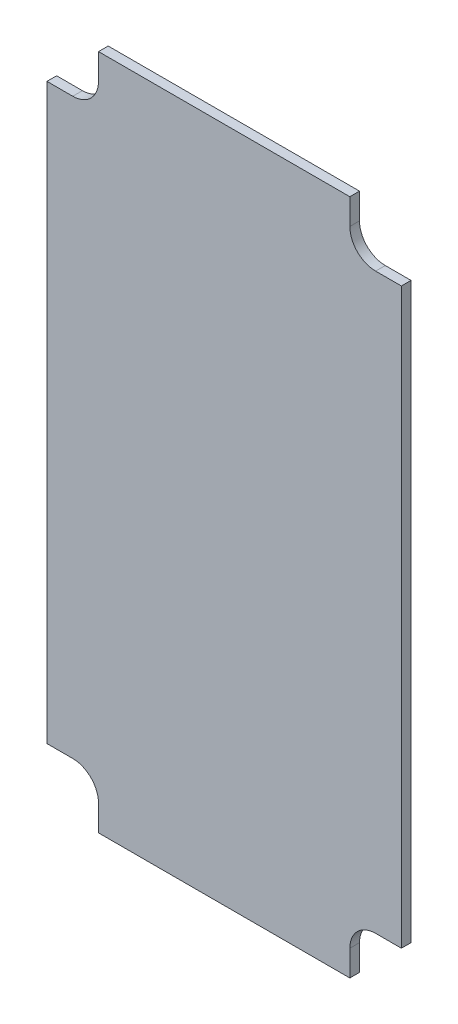
from build123d import *

# Parameters (mm, degrees)
CROQUIS1_W              = 55
CROQUIS1_H              = 105
SALIENTE_EXTRUIR1_DEPTH = 1.5
CORTAR_EXTRUIR1_REACH   = 61.285


with BuildPart() as part:
    # Croquis1 → Saliente-Extruir1 (new body)
    with BuildSketch(Plane.XY):
        Rectangle(CROQUIS1_W, CROQUIS1_H)
    extrude(amount=SALIENTE_EXTRUIR1_DEPTH)

    # Croquis2 → Cortar-Extruir1 (cut, up to next)
    with BuildSketch(Plane.XY.offset(1.5), mode=Mode.PRIVATE) as cortar_extruir1_sk1:
        with BuildLine():
            Line((-19.5, -48.5), (-19.5, -52.5))
            Line((-19.5, -52.5), (-27.5, -52.5))
            Line((-27.5, -52.5), (-27.5, -44.5))
            Line((-27.5, -44.5), (-23.5, -44.5))
            ThreePointArc((-23.5, -44.5), (-20.671572875, -45.671572875), (-19.5, -48.5))
        make_face()
    cortar_extruir1_tool1 = extrude(cortar_extruir1_sk1.sketch, amount=-CORTAR_EXTRUIR1_REACH, mode=Mode.PRIVATE) & part.part
    # Croquis2 → Cortar-Extruir1 (cut, up to next)
    with BuildSketch(Plane.XY.offset(1.5), mode=Mode.PRIVATE) as cortar_extruir1_sk2:
        with BuildLine():
            Line((19.5, -48.5), (19.5, -52.5))
            Line((19.5, -52.5), (27.5, -52.5))
            Line((27.5, -52.5), (27.5, -44.5))
            Line((27.5, -44.5), (23.5, -44.5))
            ThreePointArc((23.5, -44.5), (20.671572875, -45.671572875), (19.5, -48.5))
        make_face()
    cortar_extruir1_tool2 = extrude(cortar_extruir1_sk2.sketch, amount=-CORTAR_EXTRUIR1_REACH, mode=Mode.PRIVATE) & part.part
    # Croquis2 → Cortar-Extruir1 (cut, up to next)
    with BuildSketch(Plane.XY.offset(1.5), mode=Mode.PRIVATE) as cortar_extruir1_sk3:
        with BuildLine():
            Line((19.5, 48.5), (19.5, 52.5))
            Line((19.5, 52.5), (27.5, 52.5))
            Line((27.5, 52.5), (27.5, 44.5))
            Line((27.5, 44.5), (23.5, 44.5))
            ThreePointArc((23.5, 44.5), (20.671572875, 45.671572875), (19.5, 48.5))
        make_face()
    cortar_extruir1_tool3 = extrude(cortar_extruir1_sk3.sketch, amount=-CORTAR_EXTRUIR1_REACH, mode=Mode.PRIVATE) & part.part
    # Croquis2 → Cortar-Extruir1 (cut, up to next)
    with BuildSketch(Plane.XY.offset(1.5), mode=Mode.PRIVATE) as cortar_extruir1_sk4:
        with BuildLine():
            Line((-19.5, 48.5), (-19.5, 52.5))
            Line((-19.5, 52.5), (-27.5, 52.5))
            Line((-27.5, 52.5), (-27.5, 44.5))
            Line((-27.5, 44.5), (-23.5, 44.5))
            ThreePointArc((-23.5, 44.5), (-20.671572875, 45.671572875), (-19.5, 48.5))
        make_face()
    cortar_extruir1_tool4 = extrude(cortar_extruir1_sk4.sketch, amount=-CORTAR_EXTRUIR1_REACH, mode=Mode.PRIVATE) & part.part
    add(cortar_extruir1_tool1.solids().sort_by_distance((-23.676115, -48.676115, 1.5))[0], mode=Mode.SUBTRACT)
    add(cortar_extruir1_tool2.solids().sort_by_distance((23.676115, -48.676115, 1.5))[0], mode=Mode.SUBTRACT)
    add(cortar_extruir1_tool3.solids().sort_by_distance((23.676115, 48.676115, 1.5))[0], mode=Mode.SUBTRACT)
    add(cortar_extruir1_tool4.solids().sort_by_distance((-23.676115, 48.676115, 1.5))[0], mode=Mode.SUBTRACT)


solid = part.part
